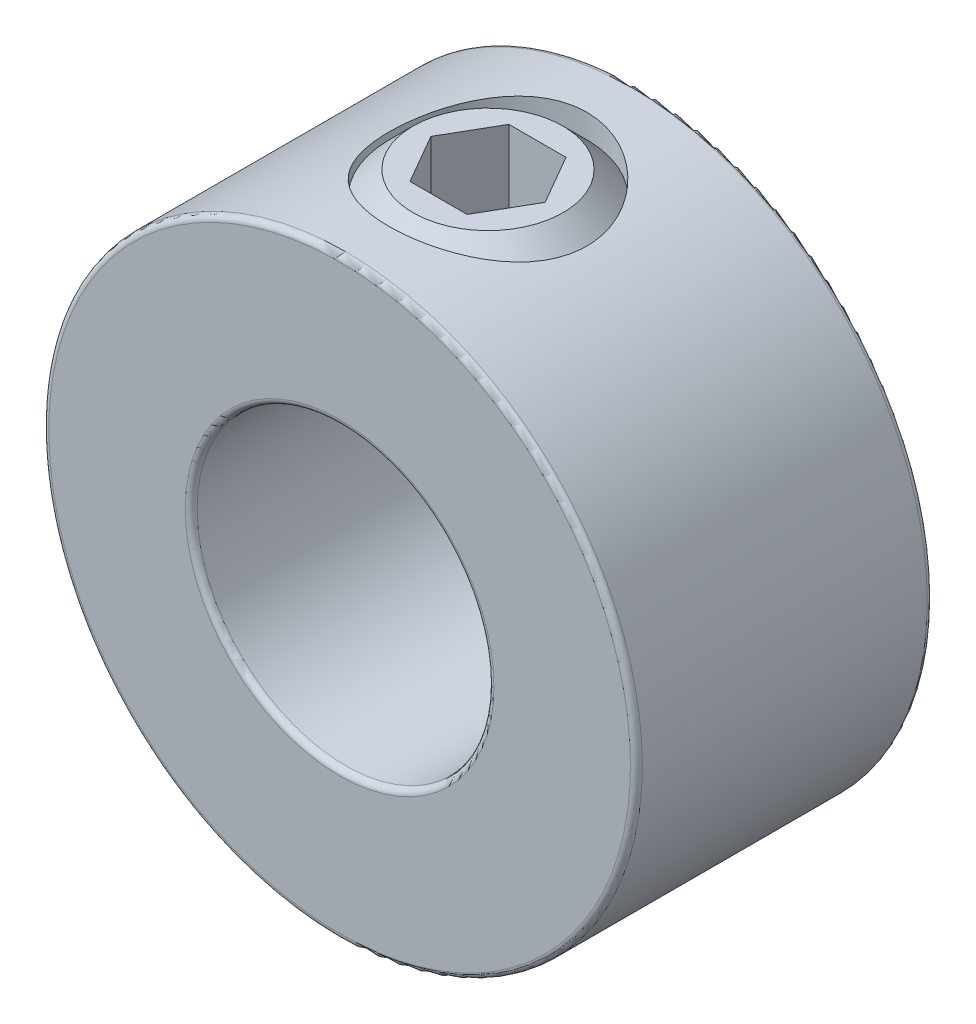
from build123d import *

# Parameters (mm, degrees)
SKETCH1_R          = 9.525
SKETCH1_R_2        = 4.7625
EXTRUDE1_DEPTH     = 4.7625
SKETCH2_R          = 3.175
CUT_EXTRUDE1_DEPTH = 52.90421015
FILLET1_R          = 0.1905
CUT_EXTRUDE2_DEPTH = 3.175


with BuildPart() as part:
    # Sketch1 → Extrude1 (new, symmetric)
    with BuildSketch(Plane.XY):
        with Locations(Location((0, 0, 0), (0, 0, 180))):
            Circle(SKETCH1_R)
        with Locations(Location((0, 0, 0), (0, 0, 180))):
            Circle(SKETCH1_R_2, mode=Mode.SUBTRACT)
    extrude(amount=EXTRUDE1_DEPTH, both=True)

    # Sketch2 → Cut-Extrude1 (cut, through all)
    with BuildSketch(Plane(origin=(41.275, 0, 0), x_dir=(0, 0, -1), z_dir=(0, -1, 0))):
        with Locations((0, -41.275)):
            Circle(SKETCH2_R)
    extrude(amount=-CUT_EXTRUDE1_DEPTH, mode=Mode.SUBTRACT)

    # Fillet1
    fillet1_edges = [part.edges().sort_by_distance(p)[0] for p in [
        (9.525, 0, -4.7625),
        (9.525, 0, 4.7625),
        (4.7625, 0, -4.7625),
        (4.7625, 0, 4.7625),
    ]]
    fillet(fillet1_edges, radius=FILLET1_R)


with BuildPart() as body_2:
    # Sketch3 → Revolve1 (revolve)
    with BuildSketch(Plane.XY):
        Polygon((-2.408192631, 4.7625), (-0.920168843, 4.7625), (0, 5.682668843), (0, 9.525), (-2.408192631, 9.525), (-3.175, 8.758192631), (-3.175, 5.529307369), align=None)
    revolve(axis=Axis((0, 4.7625, 0), (0, -1, 0)))

    # Sketch4 → Cut-Extrude2 (cut)
    with BuildSketch(Plane(origin=(3.3734375, 9.525, 0), x_dir=(0, 0, -1), z_dir=(0, -1, 0))):
        Polygon((0, -1.540350395), (-1.5875, -2.456893948), (-1.5875, -4.289981052), (0, -5.206524605), (1.5875, -4.289981052), (1.5875, -2.456893948), align=None)
    extrude(amount=CUT_EXTRUDE2_DEPTH, mode=Mode.SUBTRACT)


solid = Compound([part.part, body_2.part])
